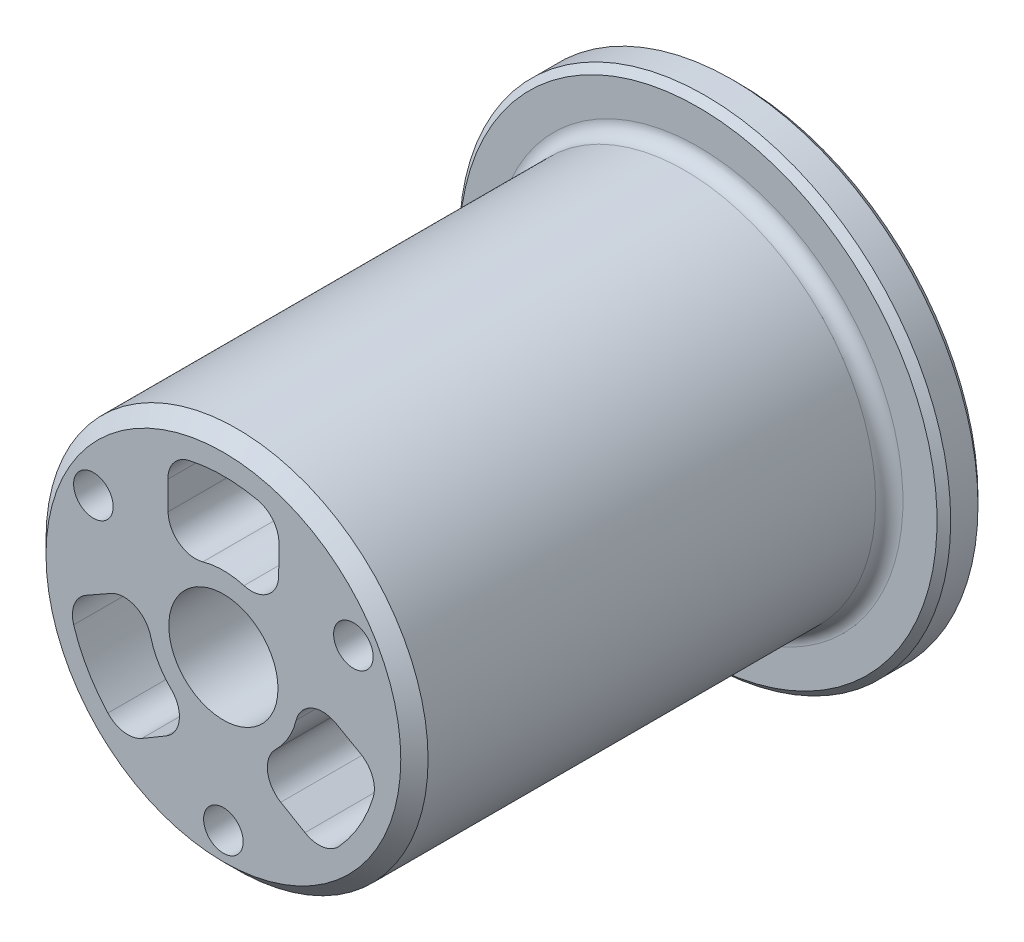
from build123d import *

# Parameters (mm, degrees)
CROQUIS1_R                      = 14
CROQUIS1_R_2                    = 4
SALIENTE_EXTRUIR1_DEPTH         = 18.9
CHAFL_N1_SIZE                   = 1
CORTAR_EXTRUIR1_REACH           = 44.671
REDONDEO1_R                     = 2
MATRIZC1_COUNT                  = 3
REDONDEO1_OF_MATRIZC1_R         = 2
CROQUIS3_R                      = 4
CORTAR_EXTRUIR2_DEPTH           = 29
TALADRO_ROSCADO_M3_5X0_61_D     = 2.9
TALADRO_ROSCADO_M3_5X0_61_DEPTH = 20
TALADRO_ROSCADO_M3_5X0_61_TIP   = 0.871247898
SALIENTE_EXTRUIR2_START         = -3
CROQUIS6_R                      = 18
CROQUIS6_R_2                    = 4
SALIENTE_EXTRUIR2_DEPTH         = 3
CHAFL_N2_SIZE                   = 0.5
REDONDEO2_R                     = 1


with BuildPart() as part:
    # Croquis1 → Saliente-Extruir1 (new, symmetric)
    with BuildSketch(Plane(origin=(0, 0, 0), x_dir=(0, 1, 0), z_dir=(0, 0, 1))):
        with Locations(Location((0, 0, 0), (0, 0, 270))):
            Circle(CROQUIS1_R)
        with Locations(Location((0, 0, 0), (0, 0, 270))):
            Circle(CROQUIS1_R_2, mode=Mode.SUBTRACT)
    extrude(amount=SALIENTE_EXTRUIR1_DEPTH, both=True)

    # Chaflán1
    chafl_n1_edges = [part.edges().sort_by_distance(p)[0] for p in [
        (-14, 0, 18.9),
    ]]
    chamfer(chafl_n1_edges, length=CHAFL_N1_SIZE)

    # Croquis2 → Cortar-Extruir1 (cut, up to next)
    with BuildSketch(Plane.XY.offset(18.9), mode=Mode.PRIVATE) as cortar_extruir1_sk1:
        with BuildLine():
            Line((4.022667121, 3.750753155), (4.08375287, 10.750486617))
            ThreePointArc((4.08375287, 10.750486617), (0, 11.5), (-4.08375287, 10.750486617))
            Line((-4.08375287, 10.750486617), (-4.022667121, 3.750753155))
            ThreePointArc((-4.022667121, 3.750753155), (0, 5.5), (4.022667121, 3.750753155))
        make_face()
    cortar_extruir1_tool1 = extrude(cortar_extruir1_sk1.sketch, amount=-CORTAR_EXTRUIR1_REACH, mode=Mode.PRIVATE) & part.part
    cortar_extruir1 = cortar_extruir1_tool1.solids().sort_by_distance((0, 8.096632, 18.9))[0]
    add(cortar_extruir1, mode=Mode.SUBTRACT)

    # Redondeo1
    redondeo1_edges = [part.edges().sort_by_distance(p)[0] for p in [
        (4.022667121, 3.750753155, 0),
        (-4.022667121, 3.750753155, 0),
        (-4.08375287, 10.750486617, 0),
        (4.08375287, 10.750486617, 0),
    ]]
    fillet(redondeo1_edges, radius=REDONDEO1_R)

    # MatrizC1: Cortar-Extruir1 ×3 about axis
    matrizc1_axis = Axis((0, 0, 0), (0, 0, 1))
    for i in range(1, MATRIZC1_COUNT):
        add(cortar_extruir1.rotate(matrizc1_axis, i * 360 / MATRIZC1_COUNT), mode=Mode.SUBTRACT)

    # Redondeo1 of MatrizC1
    redondeo1_of_matrizc1_edges = [part.edges().sort_by_distance(p)[0] for p in [
        (-5.259581076, 1.60835534, 0),
        (-1.236913955, -5.359108496, 0),
        (-7.268318079, -8.911877036, 0),
        (-11.352070948, -1.838609581, 0),
        (1.236913955, -5.359108496, 0),
        (5.259581076, 1.60835534, 0),
        (11.352070948, -1.838609581, 0),
        (7.268318079, -8.911877036, 0),
    ]]
    fillet(redondeo1_of_matrizc1_edges, radius=REDONDEO1_OF_MATRIZC1_R)

    # Croquis3 → Cortar-Extruir2 (cut)
    with BuildSketch(Plane(origin=(0, 0, 0), x_dir=(-1, 0, 0), z_dir=(0, 1, 0))):
        with Locations(Location((0, -0.4, 0), (0, 0, 90))):
            Circle(CROQUIS3_R)
    extrude(amount=-CORTAR_EXTRUIR2_DEPTH, mode=Mode.SUBTRACT)

    # Taladro roscado M3.5x0.61
    with Locations(Plane.XY.offset(18.9)):
        with Locations((0, 0), (-9.526279442, 5.5), (9.526279442, 5.5), (0, -11)):
            Hole(TALADRO_ROSCADO_M3_5X0_61_D / 2, depth=TALADRO_ROSCADO_M3_5X0_61_DEPTH)
            with Locations((0, 0, -(TALADRO_ROSCADO_M3_5X0_61_DEPTH + TALADRO_ROSCADO_M3_5X0_61_TIP / 2))):  # 118° drill point
                Cone(0, TALADRO_ROSCADO_M3_5X0_61_D / 2, TALADRO_ROSCADO_M3_5X0_61_TIP, mode=Mode.SUBTRACT)

    # Croquis6 → Saliente-Extruir2 (add)
    with BuildSketch(Plane(origin=(0, 0, -18.9), x_dir=(1, 0, 0), z_dir=(0, 0, -1)).offset(SALIENTE_EXTRUIR2_START)):
        with Locations(Location((0, 0, 0), (0, 0, 180))):
            Circle(CROQUIS6_R)
        Circle(CROQUIS6_R_2, mode=Mode.SUBTRACT)
        with BuildLine():
            Line((-10.049642775, 1.101731175), (-8.258409927, 0.08830039))
            ThreePointArc((-8.258409927, 0.08830039), (-6.485918981, -0.009361739), (-5.333946058, 1.341275307))
            ThreePointArc((-5.333946058, 1.341275307), (-4.763139721, 2.75), (-3.828551518, 3.948695135))
            ThreePointArc((-3.828551518, 3.948695135), (-3.234851986, 5.621651474), (-4.205675344, 7.107842597))
            Line((-4.205675344, 7.107842597), (-5.978948573, 8.152380354))
            ThreePointArc((-5.978948573, 8.152380354), (-7.288087529, 8.407385768), (-8.466451677, 7.782621409))
            ThreePointArc((-8.466451677, 7.782621409), (-9.959292144, 5.75), (-10.973173687, 3.440851528))
            ThreePointArc((-10.973173687, 3.440851528), (-10.92505342, 2.107976061), (-10.049642775, 1.101731175))
        make_face(mode=Mode.SUBTRACT)
        with BuildLine():
            Line((5.978948573, 8.152380354), (4.205675344, 7.107842597))
            ThreePointArc((4.205675344, 7.107842597), (3.234851986, 5.621651474), (3.828551518, 3.948695135))
            ThreePointArc((3.828551518, 3.948695135), (4.763139721, 2.75), (5.333946058, 1.341275307))
            ThreePointArc((5.333946058, 1.341275307), (6.485918981, -0.009361739), (8.258409927, 0.08830039))
            Line((8.258409927, 0.08830039), (10.049642775, 1.101731175))
            ThreePointArc((10.049642775, 1.101731175), (10.92505342, 2.107976061), (10.973173687, 3.440851528))
            ThreePointArc((10.973173687, 3.440851528), (9.959292144, 5.75), (8.466451677, 7.782621409))
            ThreePointArc((8.466451677, 7.782621409), (7.288087529, 8.407385768), (5.978948573, 8.152380354))
        make_face(mode=Mode.SUBTRACT)
        with BuildLine():
            Line((-4.052734583, -7.196142986), (-4.070694202, -9.254111529))
            ThreePointArc((-4.070694202, -9.254111529), (-3.63696589, -10.51536183), (-2.50672201, -11.223472937))
            ThreePointArc((-2.50672201, -11.223472937), (0, -11.5), (2.50672201, -11.223472937))
            ThreePointArc((2.50672201, -11.223472937), (3.63696589, -10.51536183), (4.070694202, -9.254111529))
            Line((4.070694202, -9.254111529), (4.052734583, -7.196142986))
            ThreePointArc((4.052734583, -7.196142986), (3.251066995, -5.612289735), (1.50539454, -5.289970442))
            ThreePointArc((1.50539454, -5.289970442), (0, -5.5), (-1.50539454, -5.289970442))
            ThreePointArc((-1.50539454, -5.289970442), (-3.251066995, -5.612289735), (-4.052734583, -7.196142986))
        make_face(mode=Mode.SUBTRACT)
    extrude(amount=SALIENTE_EXTRUIR2_DEPTH)

    # Chaflán2
    chafl_n2_edges = [part.edges().sort_by_distance(p)[0] for p in [
        (18, 0, -18.9),
        (18, 0, -15.9),
    ]]
    chamfer(chafl_n2_edges, length=CHAFL_N2_SIZE)

    # Redondeo2
    redondeo2_edges = [part.edges().sort_by_distance(p)[0] for p in [
        (-14, 0, -15.9),
    ]]
    fillet(redondeo2_edges, radius=REDONDEO2_R)


solid = part.part
